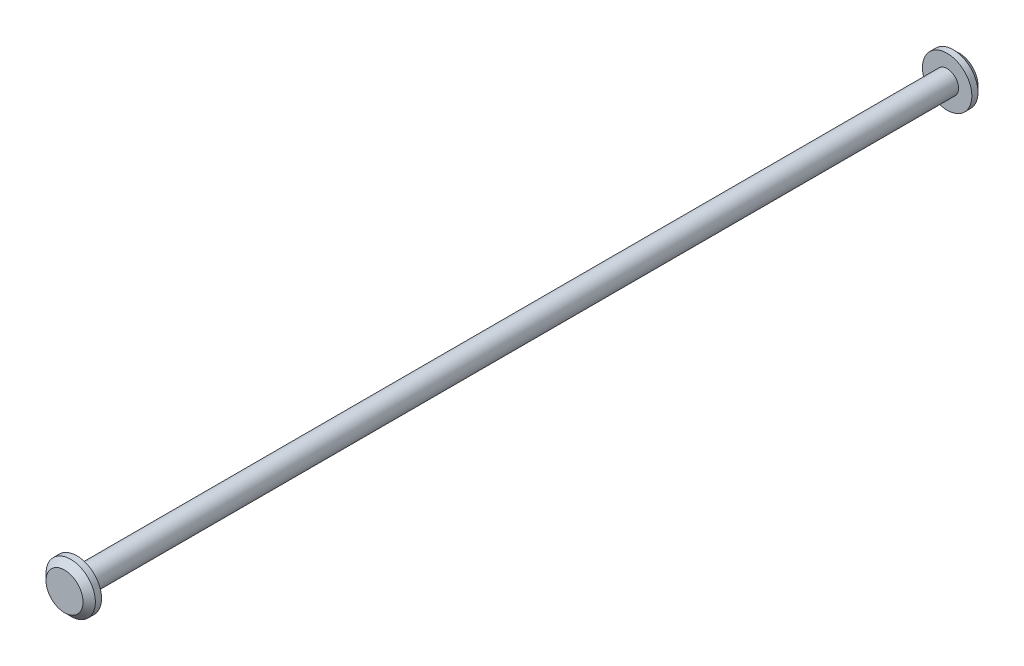
from build123d import *

# Parameters (mm, degrees)
SKETCH_1_R      = 0.925
EXTRUDE_1_DEPTH = 70.5
SKETCH_2_R      = 2
EXTRUDE_2_DEPTH = 1
EXTRUDE_START   = 1
SKETCH_3_R      = 2
EXTRUDE_3_DEPTH = 1
CHAMFER_1_SIZE  = 0.5
CHAMFER_2_SIZE  = 0.5


with BuildPart() as part:
    # 스케치1 → 보스-돌출1 (new body)
    with BuildSketch(Plane.XY):
        Circle(SKETCH_1_R)
    extrude(amount=EXTRUDE_1_DEPTH)

    # 스케치2 → 보스-돌출2 (add)
    with BuildSketch(Plane.XY.offset(70.5)):
        Circle(SKETCH_2_R)
    extrude(amount=EXTRUDE_2_DEPTH)

    # 스케치3 → 보스-돌출3 (add)
    with BuildSketch(Plane(origin=(0, 0, 0), x_dir=(-1, 0, 0), z_dir=(0, 0, -1)).offset(EXTRUDE_START)):
        with Locations(Location((0, 0, 0), (0, 0, 180))):
            Circle(SKETCH_3_R)
    extrude(amount=-EXTRUDE_3_DEPTH)

    # 모따기1
    chamfer_1_edges = [part.edges().sort_by_distance(p)[0] for p in [
        (-2, 0, 71.5),
    ]]
    chamfer(chamfer_1_edges, length=CHAMFER_1_SIZE)

    # 모따기2
    chamfer_2_edges = [part.edges().sort_by_distance(p)[0] for p in [
        (-2, 0, -1),
    ]]
    chamfer(chamfer_2_edges, length=CHAMFER_2_SIZE)


solid = part.part
